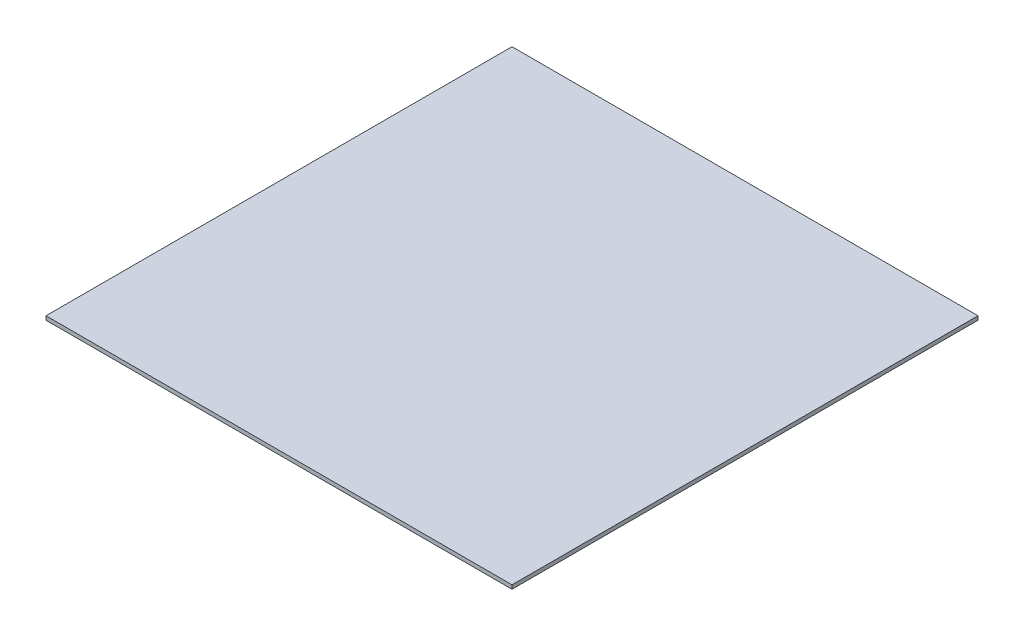
from build123d import *

# Parameters (mm, degrees)
SKETCH2_W           = 762
SKETCH2_H           = 762
BOSS_EXTRUDE1_DEPTH = 6.35


with BuildPart() as part:
    # Sketch2 → Boss-Extrude1 (new body)
    with BuildSketch(Plane(origin=(0, 0, 0), x_dir=(1, 0, 0), z_dir=(0, 1, 0))):
        Rectangle(SKETCH2_W, SKETCH2_H)
    extrude(amount=BOSS_EXTRUDE1_DEPTH)


solid = part.part
